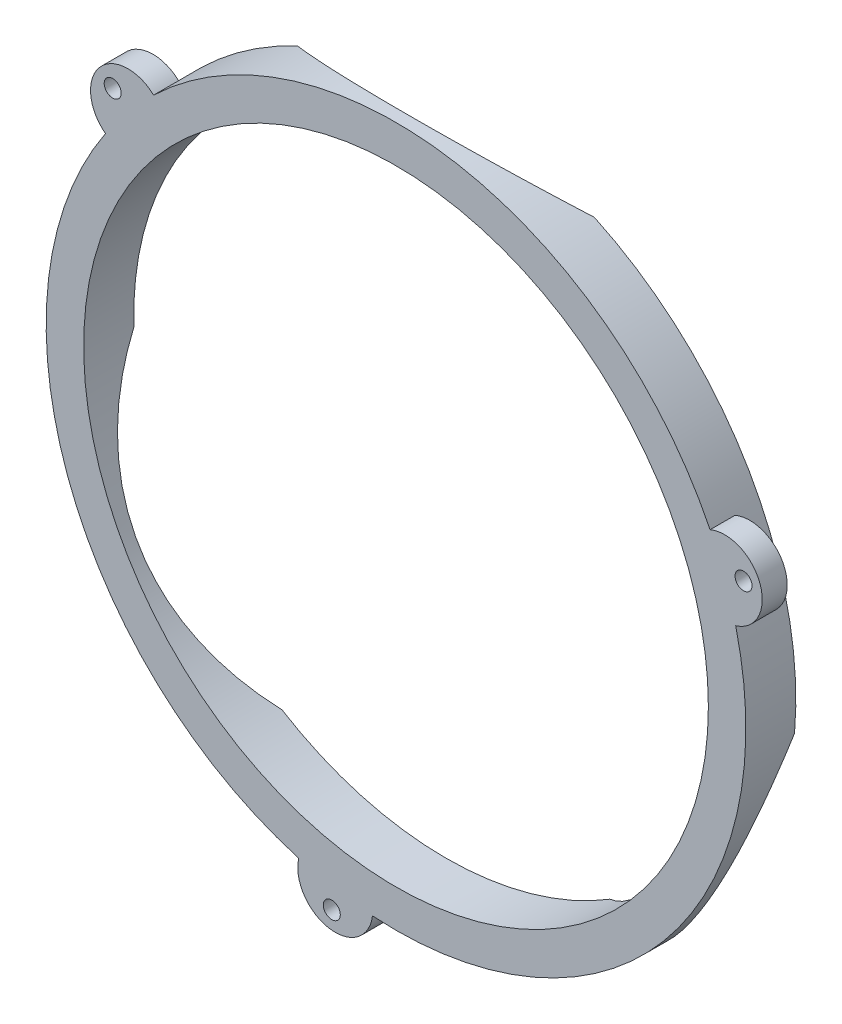
from build123d import *

# Parameters (mm, degrees)
SCHIZZO1_R                   = 70
SCHIZZO1_R_2                 = 62.5
ESTRUSIONE_ESTRUSIONE1_DEPTH = 10
ESTRUSIONE_ESTRUSIONE3_START = -5
ESTRUSIONE_ESTRUSIONE3_DEPTH = 5
FORO_PER_VITE_M3_2_D         = 3.4
RIPETIZIONECIRCOLARE3_COUNT  = 3
SCHIZZO14_R                  = 62.5
TAGLIO_ESTRUSIONE1_DEPTH     = 30
RIPETIZIONECIRCOLARE4_COUNT  = 3


with BuildPart() as part:
    # Schizzo1 → Estrusione-Estrusione1 (new body)
    with BuildSketch(Plane.XY):
        Circle(SCHIZZO1_R)
        Circle(SCHIZZO1_R_2, mode=Mode.SUBTRACT)
    extrude(amount=ESTRUSIONE_ESTRUSIONE1_DEPTH)

    # Schizzo5 → Estrusione-Estrusione3 (add)
    with BuildSketch(Plane(origin=(0, 0, 0), x_dir=(-1, 0, 0), z_dir=(0, 0, -1)).offset(ESTRUSIONE_ESTRUSIONE3_START)):
        with BuildLine():
            ThreePointArc((4.710151164, -69.841352192), (13.457733769, -76.322600858), (19.461054995, -67.240369857))
            ThreePointArc((19.461054995, -67.240369857), (12.155372437, -68.936542711), (4.710151164, -69.841352192))
        make_face()
    estrusione_estrusione3 = extrude(amount=-ESTRUSIONE_ESTRUSIONE3_DEPTH)

    # Foro per Vite M3-2 (through all)
    with Locations(Plane(origin=(0, 0, 5), x_dir=(-1, 0, 0), z_dir=(0, 0, -1))):
        with Locations((12.849965147, -72.875773723)):
            foro_per_vite_m3_2 = Hole(FORO_PER_VITE_M3_2_D / 2)

    # RipetizioneCircolare3: Estrusione-Estrusione3, Foro per Vite M3-2 ×3 about axis
    ripetizionecircolare3_axis = Axis((0, 0, 0), (0, 0, 1))
    add([estrusione_estrusione3.rotate(ripetizionecircolare3_axis, i * 360 / RIPETIZIONECIRCOLARE3_COUNT) for i in range(1, RIPETIZIONECIRCOLARE3_COUNT)])
    add([foro_per_vite_m3_2.rotate(ripetizionecircolare3_axis, i * 360 / RIPETIZIONECIRCOLARE3_COUNT) for i in range(1, RIPETIZIONECIRCOLARE3_COUNT)], mode=Mode.SUBTRACT)

    # Schizzo14 → Taglio-Estrusione1 (cut)
    with BuildSketch(Plane(origin=(-60.621778265, -35, 0), x_dir=(0, 0, -1), z_dir=(-0.8660254037844398, -0.499999999999998, 0))):
        with Locations((55, 0)):
            Circle(SCHIZZO14_R)
    taglio_estrusione1 = extrude(amount=-TAGLIO_ESTRUSIONE1_DEPTH, mode=Mode.SUBTRACT)

    # RipetizioneCircolare4: Taglio-Estrusione1 ×3 about axis
    ripetizionecircolare4_axis = Axis((0, 0, 10), (0, 0, -1))
    for i in range(1, RIPETIZIONECIRCOLARE4_COUNT):
        add(taglio_estrusione1.rotate(ripetizionecircolare4_axis, i * 360 / RIPETIZIONECIRCOLARE4_COUNT), mode=Mode.SUBTRACT)


solid = part.part
